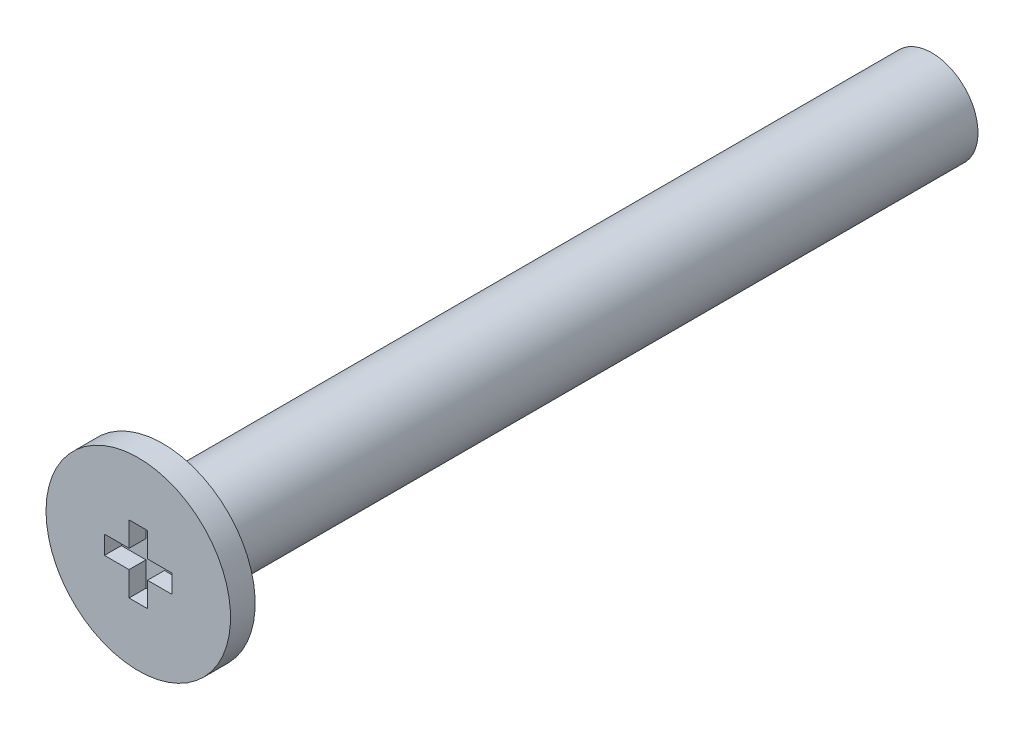
from build123d import *

# Parameters (mm, degrees)
SKETCH_1_R        = 1.5
EXTRUDE_198_DEPTH = 25
SKETCH_6_W        = 3
SKETCH_6_H        = 0.8
PH1_START         = 0.81
PH1_DEPTH         = 0.56


with BuildPart() as part:
    # 草图1 → Extrude 198 (new body)
    with BuildSketch(Plane.XY):
        Circle(SKETCH_1_R)
    extrude(amount=-EXTRUDE_198_DEPTH)

    # 草图6 → Revolve 324 (revolve)
    with BuildSketch(Plane(origin=(0, 0, 0), x_dir=(1, 0, 0), z_dir=(0, 1, 0)), mode=Mode.PRIVATE) as revolve_324_sk:
        with Locations((1.5, -0.4)):
            Rectangle(SKETCH_6_W, SKETCH_6_H)
    revolve(revolve_324_sk.sketch.rotate(Axis((0, 0, -2), (0, 0, 1)), 180), axis=Axis((0, 0, -2), (0, 0, 1)))

    # 草图7 → 十字槽_PH1_简化 (cut)
    with BuildSketch(Plane.XY.offset(PH1_START)):
        Polygon((-0.3, -1.1), (0.3, -1.1), (0.3, -0.3), (1.1, -0.3), (1.1, 0.3), (0.3, 0.3), (0.3, 1.1), (-0.3, 1.1), (-0.3, 0.3), (-1.1, 0.3), (-1.1, -0.3), (-0.3, -0.3), align=None)
    extrude(amount=-PH1_DEPTH, mode=Mode.SUBTRACT)


solid = part.part
